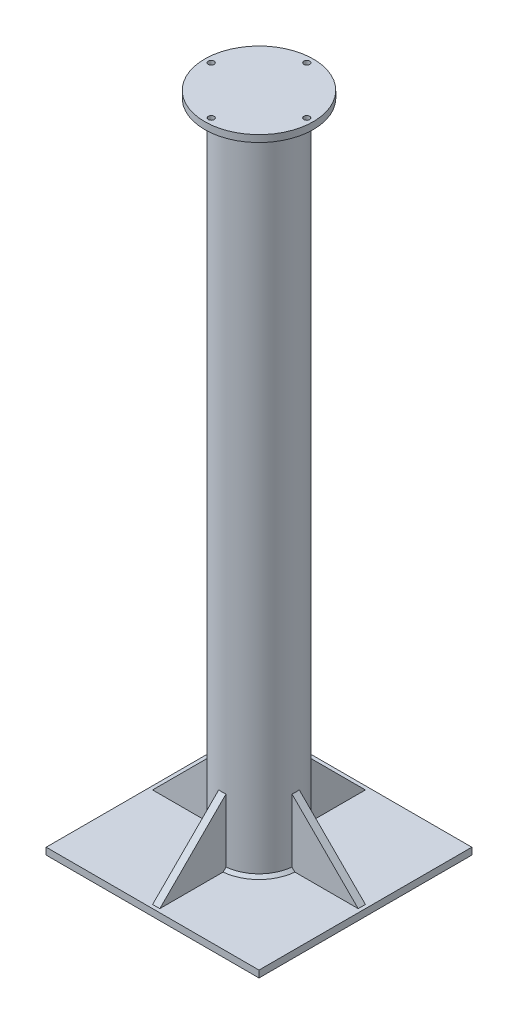
from build123d import *

# Parameters (mm, degrees)
CROQUIS1_R              = 50.8
SALIENTE_EXTRUIR1_DEPTH = 448
CROQUIS2_W              = 294
CROQUIS2_H              = 294
SALIENTE_EXTRUIR2_DEPTH = 9.5
CROQUIS3_R              = 75
SALIENTE_EXTRUIR3_DEPTH = 9.5
CORTAR_EXTRUIR1_REACH   = 940.319
CROQUIS4_R              = 4
MATRIZC1_COUNT          = 4
CHAFL_N1_SIZE           = 4
NERVIO2_REACH           = 504.518
CROQUIS5_WALL_W         = 1136.012097146
CROQUIS5_WALL_H         = 10
MATRIZC2_COUNT          = 4


with BuildPart() as part:
    # Croquis1 → Saliente-Extruir1 (new, symmetric)
    with BuildSketch(Plane(origin=(0, 0, 0), x_dir=(1, 0, 0), z_dir=(0, 1, 0))):
        with Locations(Location((0, 0, 0), (0, 0, 270))):
            Circle(CROQUIS1_R)
    extrude(amount=SALIENTE_EXTRUIR1_DEPTH, both=True)

    # Croquis2 → Saliente-Extruir2 (add)
    with BuildSketch(Plane.XZ.offset(448)):
        Rectangle(CROQUIS2_W, CROQUIS2_H)
    extrude(amount=SALIENTE_EXTRUIR2_DEPTH)

    # Croquis3 → Saliente-Extruir3 (add)
    with BuildSketch(Plane(origin=(0, 448, 0), x_dir=(1, 0, 0), z_dir=(0, 1, 0))):
        with Locations(Location((0, 0, 0), (0, 0, 270))):
            Circle(CROQUIS3_R)
    extrude(amount=SALIENTE_EXTRUIR3_DEPTH)

    # Croquis4 → Cortar-Extruir1 (cut, up to next)
    with BuildSketch(Plane(origin=(0, 457.5, 0), x_dir=(1, 0, 0), z_dir=(0, 1, 0)), mode=Mode.PRIVATE) as cortar_extruir1_sk1:
        with Locations(Location((0, 66, 0), (0, 0, 270))):
            Circle(CROQUIS4_R)
    cortar_extruir1_tool1 = extrude(cortar_extruir1_sk1.sketch, amount=-CORTAR_EXTRUIR1_REACH, mode=Mode.PRIVATE) & part.part
    cortar_extruir1 = cortar_extruir1_tool1.solids().sort_by_distance((0, 457.5, -66))[0]
    add(cortar_extruir1, mode=Mode.SUBTRACT)

    # MatrizC1: Cortar-Extruir1 ×4 about axis
    matrizc1_axis = Axis((0, 0, 0), (0, 1, 0))
    for i in range(1, MATRIZC1_COUNT):
        add(cortar_extruir1.rotate(matrizc1_axis, i * 360 / MATRIZC1_COUNT), mode=Mode.SUBTRACT)

    # Chaflán1
    chafl_n1_edges = [part.edges().sort_by_distance(p)[0] for p in [
        (0, -448, -50.8),
    ]]
    chamfer(chafl_n1_edges, length=CHAFL_N1_SIZE)

    # Croquis5 wall → Nervio2 (add, up to next)
    with BuildSketch(Plane(origin=(-96.4, -402.4, 0), x_dir=(0.707106781187, 0.707106781187, 0), z_dir=(-0.707106781187, 0.707106781187, 0)), mode=Mode.PRIVATE) as nervio2_sk1:
        Rectangle(CROQUIS5_WALL_W, CROQUIS5_WALL_H)
    nervio2_tool1 = extrude(nervio2_sk1.sketch, amount=-NERVIO2_REACH, mode=Mode.PRIVATE) - part.part
    nervio2 = nervio2_tool1.solids().sort_by_distance((-96.4, -402.4, 0))[0]
    add(nervio2)

    # MatrizC2: Nervio2 ×4 about axis
    matrizc2_axis = Axis((0, 0, 0), (0, 1, 0))
    for i in range(1, MATRIZC2_COUNT):
        add(nervio2.rotate(matrizc2_axis, i * 360 / MATRIZC2_COUNT))


solid = part.part
